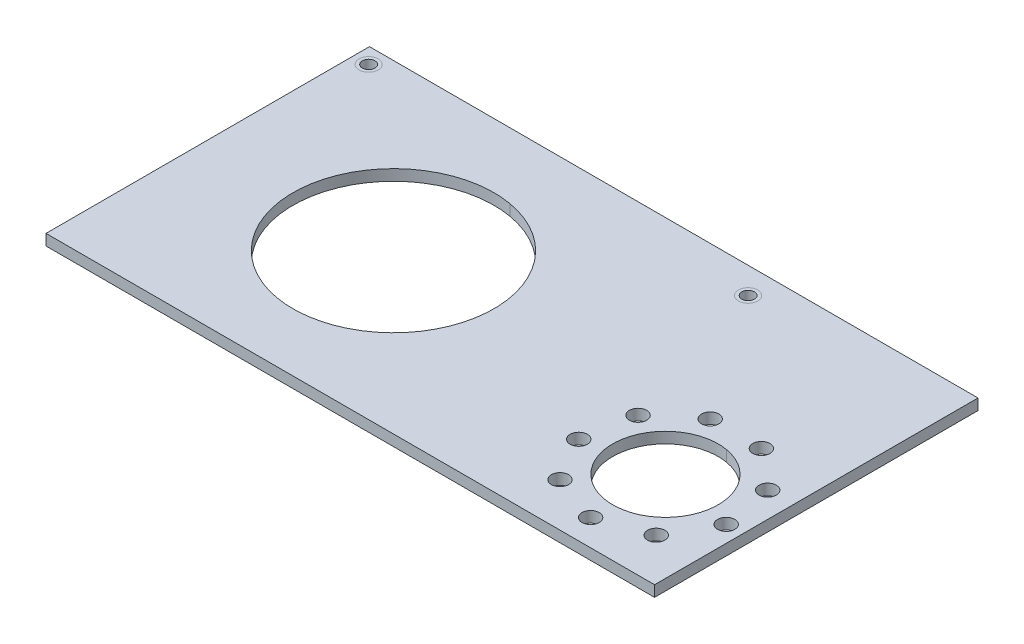
from build123d import *

# Parameters (mm, degrees)
SKETCH2_W           = 317.094917084
SKETCH2_H           = 168.536075584
SKETCH2_R           = 4.5
SKETCH2_R_2         = 27.4955
SKETCH2_R_3         = 52.3875
SKETCH2_R_4         = 3.3
BOSS_EXTRUDE1_DEPTH = 5.715


with BuildPart() as part:
    # Sketch2 → Boss-Extrude1 (new body)
    with BuildSketch(Plane(origin=(0, 0, 0), x_dir=(1, 0, 0), z_dir=(0, 1, 0))):
        with Locations((-609.090136829, -95.384753685)):
            Rectangle(SKETCH2_W, SKETCH2_H)
        with Locations(Location((-484.179723308, -90.351987789, 0), (0, 0, 270))):
            Circle(SKETCH2_R, mode=Mode.SUBTRACT)
        with Locations(Location((-510.857294488, -90.351987789, 0), (0, 0, 270))):
            Circle(SKETCH2_R, mode=Mode.SUBTRACT)
        with Locations(Location((-463.74351815, -107.5, 0), (0, 0, 270))):
            Circle(SKETCH2_R, mode=Mode.SUBTRACT)
        with Locations(Location((-531.293499646, -107.5, 0), (0, 0, 270))):
            Circle(SKETCH2_R, mode=Mode.SUBTRACT)
        with Locations(Location((-497.518508898, -127, 0), (0, 0, 270))):
            Circle(SKETCH2_R_2, mode=Mode.SUBTRACT)
        with Locations(Location((-459.111006531, -133.772278929, 0), (0, 0, 270))):
            Circle(SKETCH2_R, mode=Mode.SUBTRACT)
        with Locations(Location((-535.926011265, -133.772278929, 0), (0, 0, 270))):
            Circle(SKETCH2_R, mode=Mode.SUBTRACT)
        with Locations(Location((-472.44979212, -156.875733282, 0), (0, 0, 270))):
            Circle(SKETCH2_R, mode=Mode.SUBTRACT)
        with Locations(Location((-522.587225676, -156.875733282, 0), (0, 0, 270))):
            Circle(SKETCH2_R, mode=Mode.SUBTRACT)
        with Locations(Location((-497.518508898, -166, 0), (0, 0, 270))):
            Circle(SKETCH2_R, mode=Mode.SUBTRACT)
        with Locations(Location((-669.29, -96.951477372, 0), (0, 0, 270))):
            Circle(SKETCH2_R_3, mode=Mode.SUBTRACT)
        with Locations(Location((-759.817588698, -19.346338398, 0), (0, 0, 270))):
            Circle(SKETCH2_R_4, mode=Mode.SUBTRACT)
        with BuildLine():
            ThreePointArc((-559.922688418, -24.132284746), (-557.312350108, -28.000893528), (-553.443741326, -25.390555218))
            ThreePointArc((-553.443741326, -25.390555218), (-556.054079636, -21.521946436), (-559.922688418, -24.132284746))
        make_face(mode=Mode.SUBTRACT)
    extrude(amount=BOSS_EXTRUDE1_DEPTH)


solid = part.part
